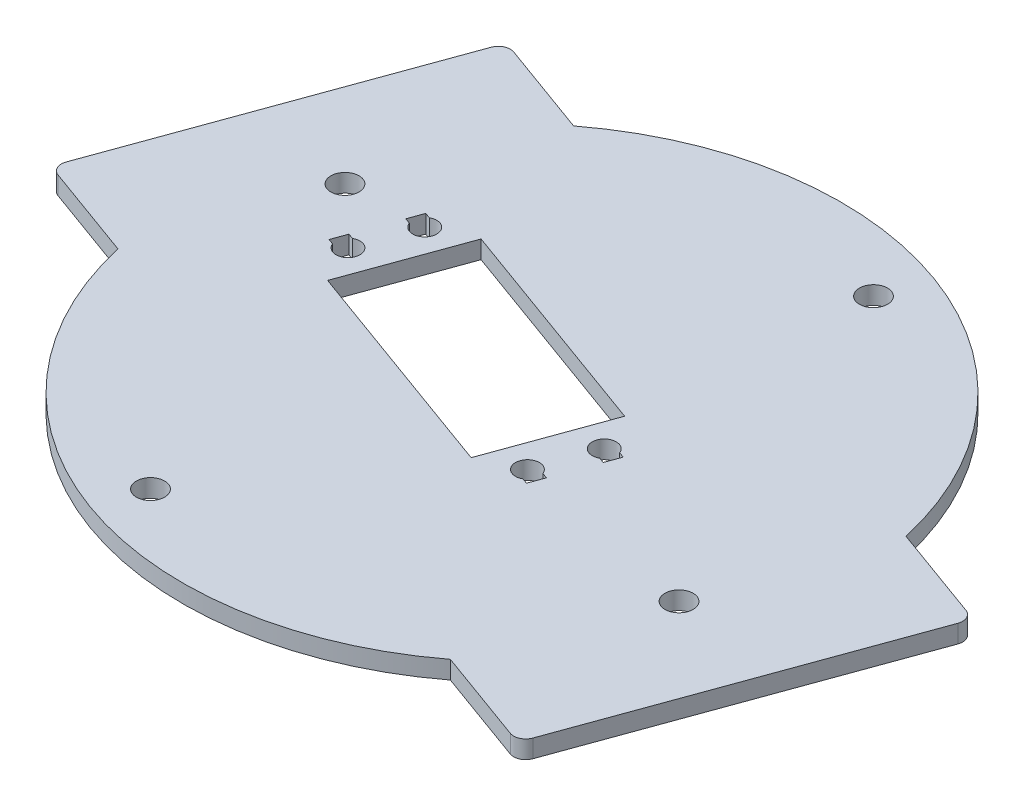
from build123d import *

# Parameters (mm, degrees)
SKETCH_10_R         = 2.35
EXTRUDE_2_DEPTH     = 3
CUT_EXTRUDE_3_DEPTH = 3


with BuildPart() as part:
    # 草图10 → 凸台-拉伸2 (new body)
    with BuildSketch(Plane(origin=(0, 0, 0), x_dir=(1, 0, 0), z_dir=(0, 1, 0))):
        with BuildLine():
            Line((33.405753886, -43.6927409), (49.102625926, -49.386437869))
            ThreePointArc((49.102625926, -49.386437869), (50.631828553, -49.317990247), (51.664738322, -48.188280923))
            Line((51.664738322, -48.188280923), (70.544015322, 3.859728807))
            ThreePointArc((70.544015322, 3.859728807), (70.4755677, 5.388931433), (69.345858375, 6.421841203))
            Line((69.345858375, 6.421841203), (53.648986335, 12.115538173))
            ThreePointArc((53.648986335, 12.115538173), (18.754387434, 51.703703465), (-33.405753886, 43.6927409))
            Line((-33.405753886, 43.6927409), (-49.102625926, 49.386437869))
            ThreePointArc((-49.102625926, 49.386437869), (-50.631828553, 49.317990247), (-51.664738322, 48.188280923))
            Line((-51.664738322, 48.188280923), (-70.544015322, -3.859728807))
            ThreePointArc((-70.544015322, -3.859728807), (-70.4755677, -5.388931433), (-69.345858375, -6.421841203))
            Line((-69.345858375, -6.421841203), (-53.648986335, -12.115538173))
            ThreePointArc((-53.648986335, -12.115538173), (-18.754387434, -51.703703465), (33.405753886, -43.6927409))
        make_face()
        with Locations(Location((16.22853422, 44.109349089, 0), (0, 0, 270))):
            Circle(SKETCH_10_R, mode=Mode.SUBTRACT)
        with Locations(Location((-44.109349089, 16.22853422, 0), (0, 0, 270))):
            Circle(SKETCH_10_R, mode=Mode.SUBTRACT)
        with Locations(Location((-16.22853422, -44.109349089, 0), (0, 0, 270))):
            Circle(SKETCH_10_R, mode=Mode.SUBTRACT)
        with Locations(Location((44.109349089, -16.22853422, 0), (0, 0, 270))):
            Circle(SKETCH_10_R, mode=Mode.SUBTRACT)
    extrude(amount=EXTRUDE_2_DEPTH)

    # 草图11 → 切除-拉伸3 (cut)
    with BuildSketch(Plane(origin=(0, 0, 0), x_dir=(1, 0, 0), z_dir=(0, 1, 0))):
        with BuildLine():
            Line((14.302948542, -11.889729308), (13.381558854, -11.555515354))
            ThreePointArc((13.381558854, -11.555515354), (11.104938847, -11.342582915), (10.515931052, -9.13319189))
            ThreePointArc((10.515931052, -9.13319189), (12.384418559, -7.81520353), (14.268129897, -9.111340281))
            Line((14.268129897, -9.111340281), (15.189519584, -9.445554235))
            Line((15.189519584, -9.445554235), (14.302948542, -11.889729308))
        make_face()
        with BuildLine():
            Line((17.678018521, 0.289333077), (18.599408209, -0.044880878))
            Line((18.599408209, -0.044880878), (17.712837166, -2.48905595))
            Line((17.712837166, -2.48905595), (16.791447479, -2.154841996))
            ThreePointArc((16.791447479, -2.154841996), (14.514827471, -1.941909558), (13.925819677, 0.267481467))
            ThreePointArc((13.925819677, 0.267481467), (15.794307183, 1.585469828), (17.678018521, 0.289333077))
        make_face()
        with BuildLine():
            Line((-33.104295256, 18.709506556), (-32.182905569, 18.375292602))
            ThreePointArc((-32.182905569, 18.375292602), (-29.317277767, 15.952969139), (-33.069476611, 15.931117529))
            Line((-33.069476611, 15.931117529), (-33.990866299, 16.265331483))
            Line((-33.990866299, 16.265331483), (-33.104295256, 18.709506556))
        make_face()
        with BuildLine():
            Line((-36.514183881, 9.308833199), (-35.592794193, 8.974619245))
            ThreePointArc((-35.592794193, 8.974619245), (-32.727166391, 6.552295782), (-36.479365236, 6.530444172))
            Line((-36.479365236, 6.530444172), (-37.400754923, 6.864658126))
            Line((-37.400754923, 6.864658126), (-36.514183881, 9.308833199))
        make_face()
        Polygon((-24.792131447, 19.63033923), (-31.611908696, 0.828992516), (5.990784733, -12.810561982), (12.810561982, 5.990784733), align=None)
    extrude(amount=CUT_EXTRUDE_3_DEPTH, mode=Mode.SUBTRACT)


solid = part.part
